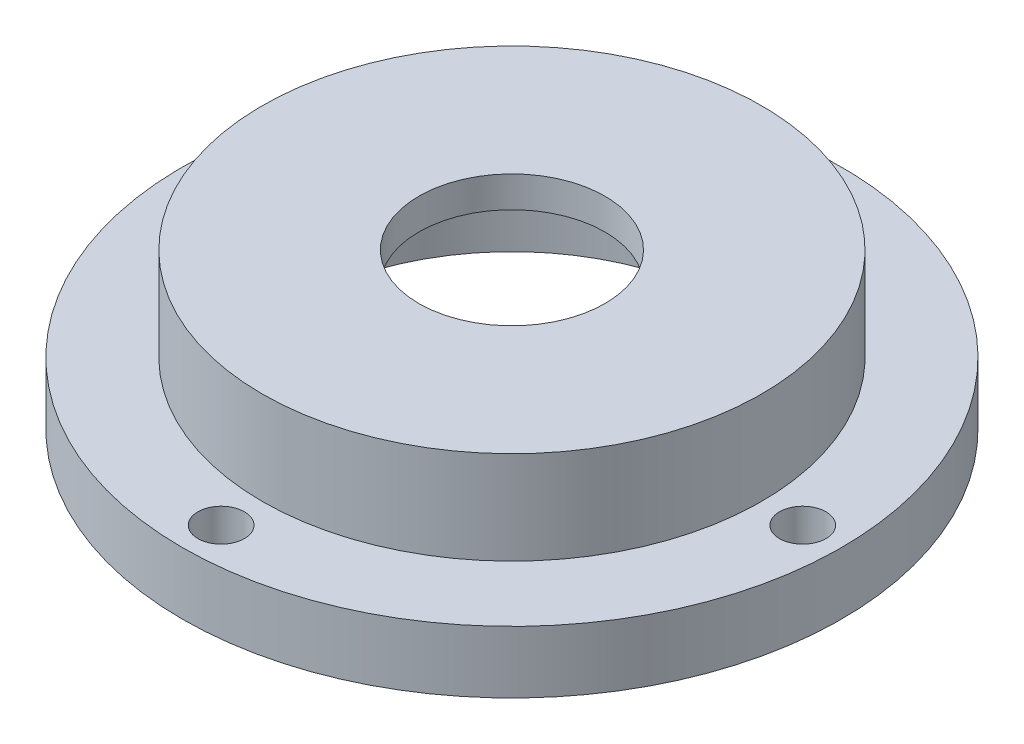
from build123d import *

# Parameters (mm, degrees)
SKETCH_1_R          = 21.25
EXTRUDE_1_DEPTH     = 4
SKETCH_2_R          = 16.1
EXTRUDE_2_DEPTH     = 6
SKETCH_3_R          = 14
CUT_EXTRUDE_3_DEPTH = 8
SKETCH_4_R          = 6
CUT_EXTRUDE_4_DEPTH = 32.672148648
SKETCH_5_R          = 1.5
CUT_EXTRUDE_5_DEPTH = 10


with BuildPart() as part:
    # Эскиз1 → Вытянуть1 (new body)
    with BuildSketch(Plane(origin=(0, 0, 0), x_dir=(1, 0, 0), z_dir=(0, 1, 0))):
        with Locations(Location((0, 0, 0), (0, 0, 270))):
            Circle(SKETCH_1_R)
    extrude(amount=EXTRUDE_1_DEPTH)

    # Эскиз2 → Вытянуть2 (add)
    with BuildSketch(Plane(origin=(0, 4, 0), x_dir=(-1, 0, 0), z_dir=(0, 1, 0))):
        with Locations(Location((0, 0, 0), (0, 0, 90))):
            Circle(SKETCH_2_R)
    extrude(amount=EXTRUDE_2_DEPTH)

    # Эскиз3 → Вытянуть3 (cut)
    with BuildSketch(Plane.XZ):
        with Locations(Location((0, 0, 0), (0, 0, 270))):
            Circle(SKETCH_3_R)
    extrude(amount=-CUT_EXTRUDE_3_DEPTH, mode=Mode.SUBTRACT)

    # Эскиз4 → Вытянуть4 (cut, through all)
    with BuildSketch(Plane(origin=(0, 10, 0), x_dir=(1, 0, 0), z_dir=(0, 1, 0))):
        with Locations(Location((0, 0, 0), (0, 0, 270))):
            Circle(SKETCH_4_R)
    extrude(amount=-CUT_EXTRUDE_4_DEPTH, mode=Mode.SUBTRACT)

    # Эскиз5 → Вытянуть5 (cut)
    with BuildSketch(Plane(origin=(0, 4, 0), x_dir=(1, 0, 0), z_dir=(0, 1, 0))):
        with Locations(Location((0, 18.75, 0), (0, 0, 270))):
            Circle(SKETCH_5_R)
        with Locations(Location((18.75, 0, 0), (0, 0, 270))):
            Circle(SKETCH_5_R)
        with Locations(Location((0, -18.75, 0), (0, 0, 270))):
            Circle(SKETCH_5_R)
        with Locations(Location((-18.75, 0, 0), (0, 0, 270))):
            Circle(SKETCH_5_R)
    extrude(amount=-CUT_EXTRUDE_5_DEPTH, mode=Mode.SUBTRACT)


solid = part.part
